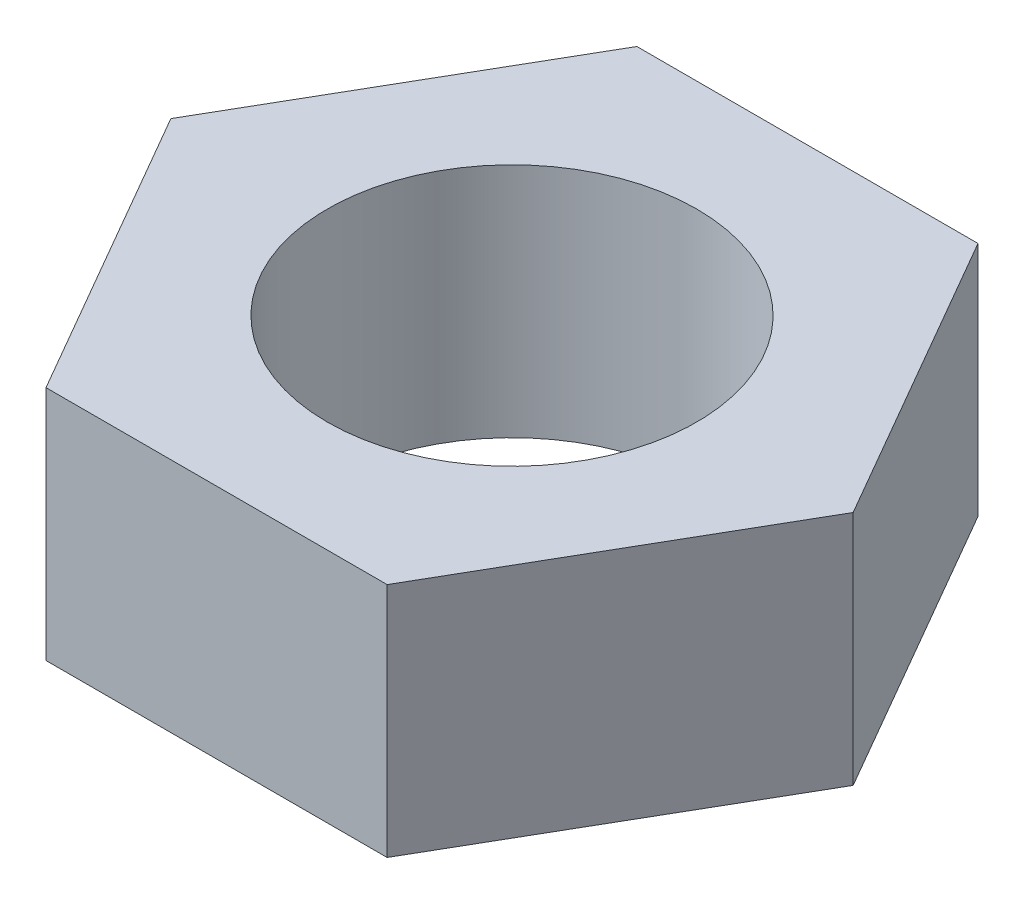
from build123d import *

# Parameters (mm, degrees)
EXTRUDE_1_DEPTH     = 1.6
SKETCH_2_R          = 1.25
CUT_EXTRUDE_1_DEPTH = 2.4


with BuildPart() as part:
    # Эскиз1 → Бобышка-Вытянуть1 (new body)
    with BuildSketch(Plane(origin=(0, 0, 0), x_dir=(1, 0, 0), z_dir=(0, 1, 0))):
        Polygon((-2.309401077, 0), (-1.154700538, -2), (1.154700538, -2), (2.309401077, 0), (1.154700538, 2), (-1.154700538, 2), align=None)
    extrude(amount=EXTRUDE_1_DEPTH)

    # Эскиз2 → Вырез-Вытянуть1 (cut)
    with BuildSketch(Plane(origin=(0, 1.6, 0), x_dir=(1, 0, 0), z_dir=(0, 1, 0))):
        with Locations(Location((0, 0, 0), (0, 0, 270))):
            Circle(SKETCH_2_R)
    extrude(amount=-CUT_EXTRUDE_1_DEPTH, mode=Mode.SUBTRACT)


solid = part.part
